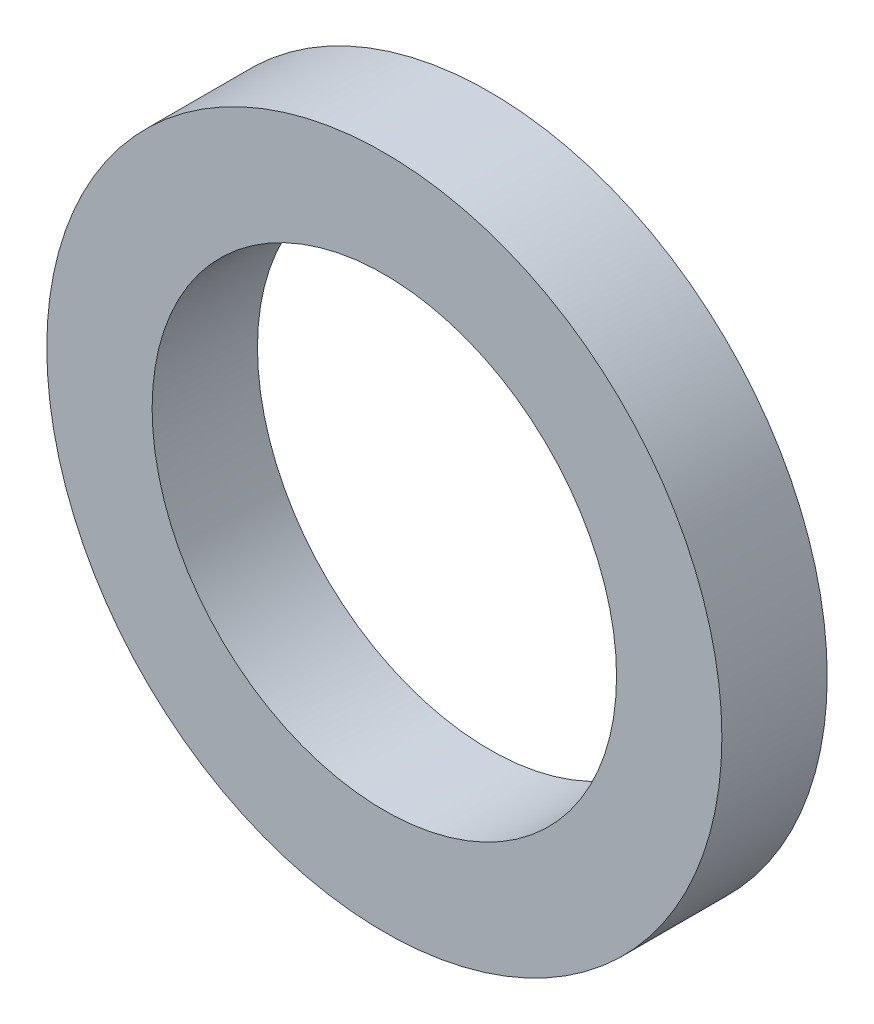
from build123d import *

# Parameters (mm, degrees)
SKETCH1_R                = 2
BOSS_EXTRUDE1_DEPTH      = 6.35
CUT_EXTRUDE1_DEPTH       = 93.473426076
CUT_EXTRUDE1_DEPTH_BACK  = 93.473426076
SKETCH2_R                = 7
BOSS_EXTRUDE2_DEPTH      = 31.75
BOSS_EXTRUDE2_DEPTH_BACK = 12.7
SKETCH5_R                = 7
SKETCH6_R                = 7
BOSS_EXTRUDE3_DEPTH      = 6.35
FILLET1_R                = 6.35
FILLET2_R                = 3.175
SKETCH7_R                = 10.175
SKETCH7_R_2              = 7
BOSS_EXTRUDE4_DEPTH      = 3.175


with BuildPart() as part:
    # Sketch1 → Boss-Extrude1 (new, symmetric)
    # profile 1 of 3: a face of its own
    with BuildSketch(Plane.XY):
        Polygon((22.188571811, 51.670547503), (22.188571811, 37.229452497), (13.9055, 25.4), (13.9055, 0), (52.0055, 0), (52.0055, 25.4), (26.6055, 76.2), (13.9055, 76.2), (13.9055, 63.5), align=None)
        with Locations((33.493, 8.8)):
            Circle(SKETCH1_R, mode=Mode.SUBTRACT)
        with Locations((17.493, 8.8)):
            Circle(SKETCH1_R, mode=Mode.SUBTRACT)
    # profile 2 of 3: a face of its own
    with BuildSketch(Plane.XY):
        with Locations((17.493, 8.8)):
            Circle(SKETCH1_R)
    # profile 3 of 3: a face of its own
    with BuildSketch(Plane.XY):
        with Locations((33.493, 8.8)):
            Circle(SKETCH1_R)
    extrude(amount=BOSS_EXTRUDE1_DEPTH, both=True)

    # Sketch2 → Cut-Extrude1 (cut, two sides: drawn at the far end of the back side and taken through both)
    with BuildSketch(Plane.XY.offset(-CUT_EXTRUDE1_DEPTH_BACK)):
        with Locations((25.493, 16.8)):
            Circle(SKETCH2_R)
    extrude(amount=CUT_EXTRUDE1_DEPTH + CUT_EXTRUDE1_DEPTH_BACK, mode=Mode.SUBTRACT)

    # Fillet2
    fillet2_edges = [part.edges().sort_by_distance(p)[0] for p in [
        (22.188571811, 51.670547503, 0),
        (13.9055, 63.5, 0),
        (13.9055, 76.2, 0),
        (26.6055, 76.2, 0),
        (52.0055, 25.4, 0),
        (52.0055, 0, 0),
        (13.9055, 0, 0),
        (13.9055, 25.4, 0),
        (22.188571811, 37.229452497, 0),
    ]]
    fillet(fillet2_edges, radius=FILLET2_R)


with BuildPart() as body_2:
    # Sketch5 → Boss-Extrude2 (new, two sides: drawn at the far end of the back side and taken through both)
    with BuildSketch(Plane.XY.offset(6.35).offset(-BOSS_EXTRUDE2_DEPTH_BACK)):
        with Locations((25.493, 16.8)):
            Circle(SKETCH5_R)
    extrude(amount=BOSS_EXTRUDE2_DEPTH + BOSS_EXTRUDE2_DEPTH_BACK)


with BuildPart() as body_3:
    # Sketch6 → Boss-Extrude3 (new, symmetric)
    # profile 1 of 2: a face of its own
    with BuildSketch(Plane.XY.offset(15.875)):
        Polygon((0, -22.225), (0, 0), (-14.3805, 0), (-14.3805, 30.15), (-36.6055, 30.15), (-36.6055, -22.225), (-14.3805, -22.225), align=None)
        with Locations((-25.493, 16.8)):
            Circle(SKETCH6_R, mode=Mode.SUBTRACT)
    # profile 2 of 2: a face of its own
    with BuildSketch(Plane.XY.offset(15.875)):
        Polygon((14.3805, 30.15), (14.3805, 0), (0, 0), (0, -22.225), (14.3805, -22.225), (36.6055, -22.225), (36.6055, 30.15), align=None)
        with Locations((25.493, 16.8)):
            Circle(SKETCH6_R, mode=Mode.SUBTRACT)
    extrude(amount=BOSS_EXTRUDE3_DEPTH, both=True)

    # Fillet1
    fillet1_edges = [body_3.edges().sort_by_distance(p)[0] for p in [
        (-14.3805, 0, 15.875),
        (14.3805, 0, 15.875),
        (14.3805, 30.15, 15.875),
        (36.6055, 30.15, 15.875),
        (36.6055, -22.225, 15.875),
        (-36.6055, -22.225, 15.875),
        (-36.6055, 30.15, 15.875),
        (-14.3805, 30.15, 15.875),
    ]]
    fillet(fillet1_edges, radius=FILLET1_R)


with BuildPart() as body_4:
    # Sketch7 → Boss-Extrude4 (new body)
    with BuildSketch(Plane.XY.offset(6.35)):
        with Locations((25.493, 16.8)):
            Circle(SKETCH7_R)
        with Locations((25.493, 16.8)):
            Circle(SKETCH7_R_2, mode=Mode.SUBTRACT)
    extrude(amount=BOSS_EXTRUDE4_DEPTH)


solid = body_4.part
